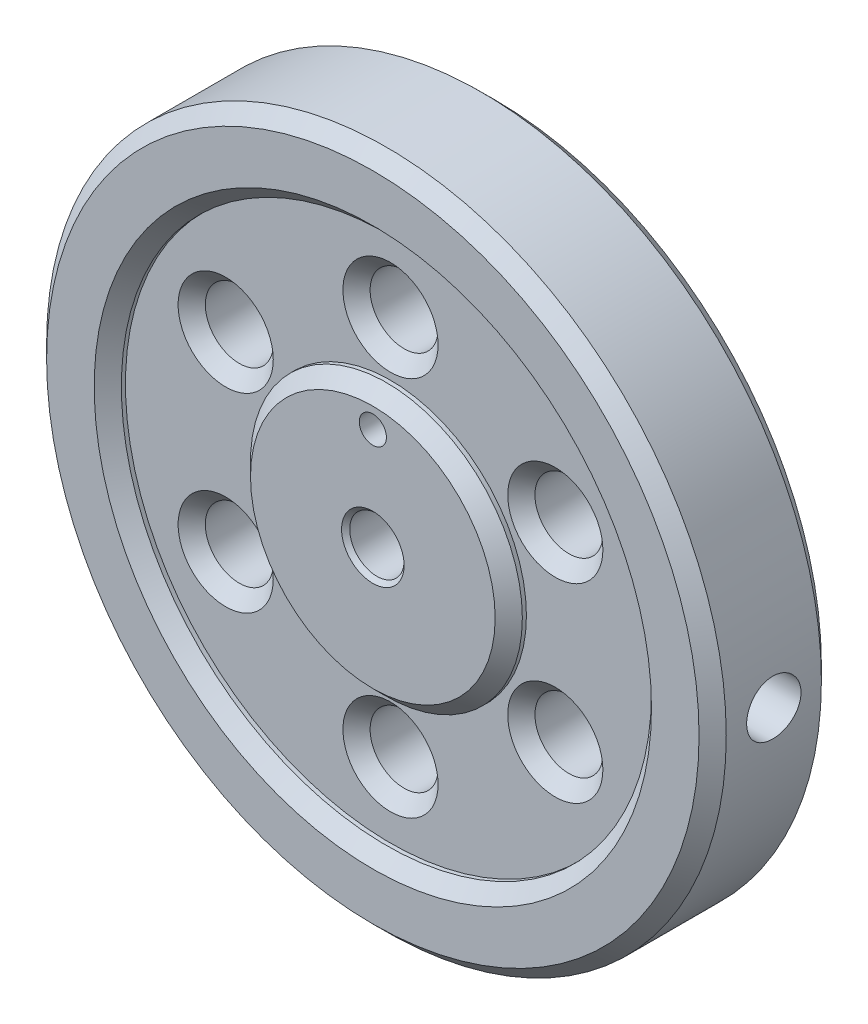
from build123d import *

# Parameters (mm, degrees)
SKETCH_1_R               = 25
EXTRUDE_1_DEPTH          = 4.5
SKETCH_2_R               = 2
CUT_EXTRUDE_1_DEPTH      = 37.482872694
CHAMFER_1_SIZE           = 1
SKETCH_3_R               = 19.5
SKETCH_3_R_2             = 10
CUT_EXTRUDE_2_DEPTH      = 1.3
CHAMFER_2_SIZE           = 1
CHAMFER_3_SIZE           = 1
SKETCH_4_R               = 1
CUT_EXTRUDE_3_DEPTH      = 2
CHAMFER_4_SIZE           = 0.3
CHAMFER_5_SIZE           = 1
SKETCH_5_R               = 8
SKETCH_5_R_2             = 3.5
CUT_EXTRUDE_4_DEPTH      = 0.3
SKETCH_6_R               = 2.5
CUT_EXTRUDE_5_DEPTH      = 37.184112536
CHAMFER_6_SIZE           = 1
CUT_EXTRUDE_START        = 10
SKETCH_7_R               = 2
CUT_EXTRUDE_6_DEPTH      = 20
CUT_EXTRUDE_7_REACH      = 45.246
CUT_EXTRUDE_7_END_RADIUS = 2
SKETCH_8_R               = 1.5


with BuildPart() as part:
    # 草图1 → 凸台-拉伸1 (new, symmetric)
    with BuildSketch(Plane.XY):
        Circle(SKETCH_1_R)
    extrude(amount=EXTRUDE_1_DEPTH, both=True)

    # 草图2 → 切除-拉伸1 (cut, through all)
    with BuildSketch(Plane.XY.offset(4.5)):
        Circle(SKETCH_2_R)
    extrude(amount=-CUT_EXTRUDE_1_DEPTH, mode=Mode.SUBTRACT)

    # 倒角1
    chamfer_1_edges = [part.edges().sort_by_distance(p)[0] for p in [
        (-25, 0, -4.5),
        (-25, 0, 4.5),
    ]]
    chamfer(chamfer_1_edges, length=CHAMFER_1_SIZE)

    # 草图3 → 切除-拉伸2 (cut)
    with BuildSketch(Plane.XY.offset(4.5)):
        Circle(SKETCH_3_R)
        Circle(SKETCH_3_R_2, mode=Mode.SUBTRACT)
    cut_extrude_2 = extrude(amount=-CUT_EXTRUDE_2_DEPTH, mode=Mode.SUBTRACT)

    # 倒角2
    chamfer_2_edges = [part.edges().sort_by_distance(p)[0] for p in [
        (-19.5, 0, 4.5),
    ]]
    chamfer(chamfer_2_edges, length=CHAMFER_2_SIZE)

    # 倒角3
    chamfer_3_edges = [part.edges().sort_by_distance(p)[0] for p in [
        (-10, 0, 4.5),
    ]]
    chamfer(chamfer_3_edges, length=CHAMFER_3_SIZE)

    # 草图4 → 切除-拉伸3 (cut)
    with BuildSketch(Plane.XY.offset(4.5)):
        with Locations((0, 7.5)):
            Circle(SKETCH_4_R)
    extrude(amount=-CUT_EXTRUDE_3_DEPTH, mode=Mode.SUBTRACT)

    # 倒角4
    chamfer_4_edges = [part.edges().sort_by_distance(p)[0] for p in [
        (-2, 0, -4.5),
        (-2, 0, 4.5),
    ]]
    chamfer(chamfer_4_edges, length=CHAMFER_4_SIZE)

    # 镜向3: 切除-拉伸2 across plane
    add(cut_extrude_2.mirror(Plane.XY), mode=Mode.SUBTRACT)

    # 倒角5
    chamfer_5_edges = [part.edges().sort_by_distance(p)[0] for p in [
        (-10, 0, -4.5),
        (-19.5, 0, -4.5),
    ]]
    chamfer(chamfer_5_edges, length=CHAMFER_5_SIZE)

    # 草图5 → 切除-拉伸4 (cut)
    with BuildSketch(Plane(origin=(0, 0, -4.5), x_dir=(-1, 0, 0), z_dir=(0, 0, -1))):
        Circle(SKETCH_5_R)
        Circle(SKETCH_5_R_2, mode=Mode.SUBTRACT)
    extrude(amount=-CUT_EXTRUDE_4_DEPTH, mode=Mode.SUBTRACT)

    # 草图6 → 切除-拉伸5 (cut, through all)
    with BuildSketch(Plane.XY.offset(3.2)):
        with Locations((0, 14)):
            Circle(SKETCH_6_R)
        with Locations((12.124355653, 7)):
            Circle(SKETCH_6_R)
        with Locations((12.124355653, -7)):
            Circle(SKETCH_6_R)
        with Locations((0, -14)):
            Circle(SKETCH_6_R)
        with Locations((-12.124355653, -7)):
            Circle(SKETCH_6_R)
        with Locations((-12.124355653, 7)):
            Circle(SKETCH_6_R)
    extrude(amount=-CUT_EXTRUDE_5_DEPTH, mode=Mode.SUBTRACT)

    # 倒角6
    chamfer_6_edges = [part.edges().sort_by_distance(p)[0] for p in [
        (-2.5, 14, -3.2),
        (-2.5, 14, 3.2),
        (-14.624355653, 7, -3.2),
        (-14.624355653, 7, 3.2),
        (-14.624355653, -7, -3.2),
        (-14.624355653, -7, 3.2),
        (-2.5, -14, -3.2),
        (-2.5, -14, 3.2),
        (9.624355653, -7, -3.2),
        (9.624355653, -7, 3.2),
        (9.624355653, 7, -3.2),
        (9.624355653, 7, 3.2),
    ]]
    chamfer(chamfer_6_edges, length=CHAMFER_6_SIZE)

    # 草图7 → 切除-拉伸6 (cut)
    with BuildSketch(Plane(origin=(0, 0, 0), x_dir=(0, 0, -1), z_dir=(1, 0, 0)).offset(CUT_EXTRUDE_START)):
        Circle(SKETCH_7_R)
    extrude(amount=CUT_EXTRUDE_6_DEPTH, mode=Mode.SUBTRACT)

    # 切除-拉伸7: up to this cylinder (the profile starts outside it)
    cut_extrude_7_end = Plane(origin=(0, 0, 0), z_dir=(0, 0, 1)) * Cylinder(CUT_EXTRUDE_7_END_RADIUS, 95.492, mode=Mode.PRIVATE)
    # 草图8 → 切除-拉伸7 (cut, up to the surface)
    with BuildSketch(Plane(origin=(10, 0, 0), x_dir=(0, 0, -1), z_dir=(1, 0, 0)), mode=Mode.PRIVATE) as cut_extrude_7_sk1:
        Circle(SKETCH_8_R)
    cut_extrude_7_tool1 = extrude(cut_extrude_7_sk1.sketch, amount=-CUT_EXTRUDE_7_REACH, mode=Mode.PRIVATE) - cut_extrude_7_end
    add(cut_extrude_7_tool1.solids().sort_by_distance((10, 0, 0))[0], mode=Mode.SUBTRACT)


solid = part.part
